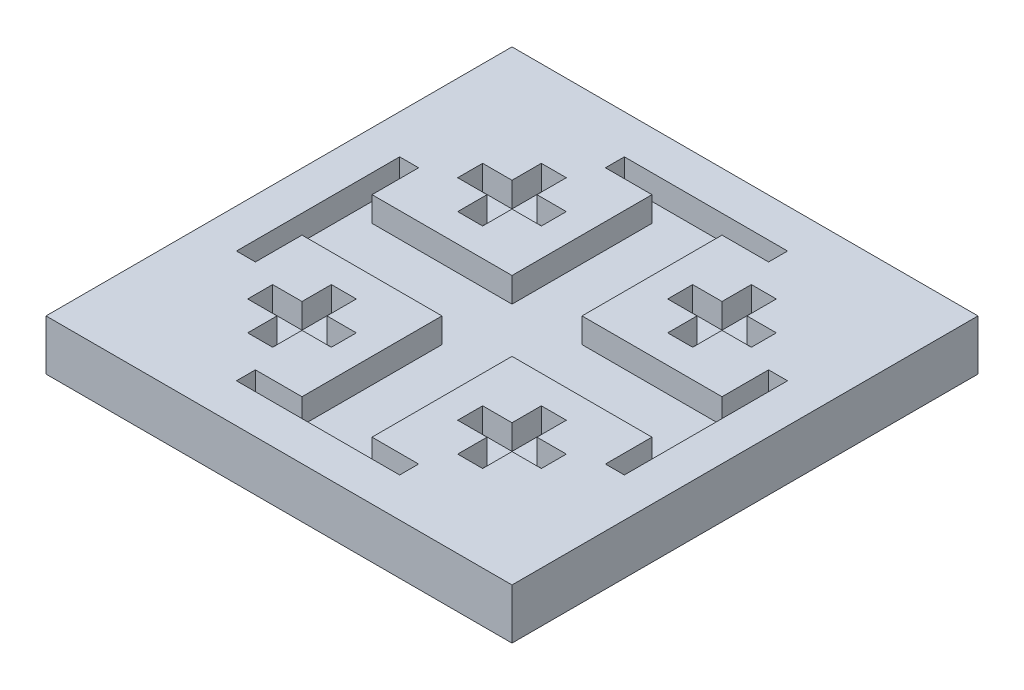
from build123d import *

# Parameters (mm, degrees)
SKETCH1_W           = 47.625
SKETCH1_H           = 47.625
BOSS_EXTRUDE1_DEPTH = 5.15
CUT_EXTRUDE1_DEPTH  = 2.54


with BuildPart() as part:
    # Sketch1 → Boss-Extrude1 (new body)
    with BuildSketch(Plane(origin=(0, 0, 0), x_dir=(1, 0, 0), z_dir=(0, 1, 0))):
        with Locations((23.8125, 23.8125)):
            Rectangle(SKETCH1_W, SKETCH1_H)
    extrude(amount=BOSS_EXTRUDE1_DEPTH)

    # Sketch2 → Cut-Extrude1 (cut)
    with BuildSketch(Plane(origin=(0, 5.15, 0), x_dir=(1, 0, 0), z_dir=(0, 1, 0))):
        Polygon((20.234147834, 27.390852166), (5.928370013, 27.390852166), (5.928370013, 32.150779252), (3.990438648, 32.150779252), (3.990438648, 15.474220748), (5.928370013, 15.474220748), (5.928370013, 20.234147834), (20.234147834, 20.234147834), (20.234147834, 5.928370013), (15.474220748, 5.928370013), (15.474220748, 3.990438648), (32.150779252, 3.990438648), (32.150779252, 5.928370013), (27.390852166, 5.928370013), (27.390852166, 20.234147834), (41.696629987, 20.234147834), (41.696629987, 15.474220748), (43.634561352, 15.474220748), (43.634561352, 32.150779252), (41.696629987, 32.150779252), (41.696629987, 27.390852166), (27.390852166, 27.390852166), (27.390852166, 41.696629987), (32.150779252, 41.696629987), (32.150779252, 43.634561352), (15.474220748, 43.634561352), (15.474220748, 41.696629987), (20.234147834, 41.696629987), align=None)
        Polygon((17.356946081, 35.819869232), (17.356946081, 33.26761292), (14.35738708, 33.26761292), (14.35738708, 30.268053919), (11.805130768, 30.268053919), (11.805130768, 33.26761292), (8.805571767, 33.26761292), (8.805571767, 35.819869232), (11.805130768, 35.819869232), (11.805130768, 38.819428233), (14.35738708, 38.819428233), (14.35738708, 35.819869232), align=None)
        Polygon((35.819869232, 30.268053919), (33.26761292, 30.268053919), (33.26761292, 33.26761292), (30.268053919, 33.26761292), (30.268053919, 35.819869232), (33.26761292, 35.819869232), (33.26761292, 38.819428233), (35.819869232, 38.819428233), (35.819869232, 35.819869232), (38.819428233, 35.819869232), (38.819428233, 33.26761292), (35.819869232, 33.26761292), align=None)
        Polygon((30.268053919, 11.805130768), (30.268053919, 14.35738708), (33.26761292, 14.35738708), (33.26761292, 17.356946081), (35.819869232, 17.356946081), (35.819869232, 14.35738708), (38.819428233, 14.35738708), (38.819428233, 11.805130768), (35.819869232, 11.805130768), (35.819869232, 8.805571767), (33.26761292, 8.805571767), (33.26761292, 11.805130768), align=None)
        Polygon((11.805130768, 17.356946081), (14.35738708, 17.356946081), (14.35738708, 14.35738708), (17.356946081, 14.35738708), (17.356946081, 11.805130768), (14.35738708, 11.805130768), (14.35738708, 8.805571767), (11.805130768, 8.805571767), (11.805130768, 11.805130768), (8.805571767, 11.805130768), (8.805571767, 14.35738708), (11.805130768, 14.35738708), align=None)
    extrude(amount=-CUT_EXTRUDE1_DEPTH, mode=Mode.SUBTRACT)


solid = part.part
